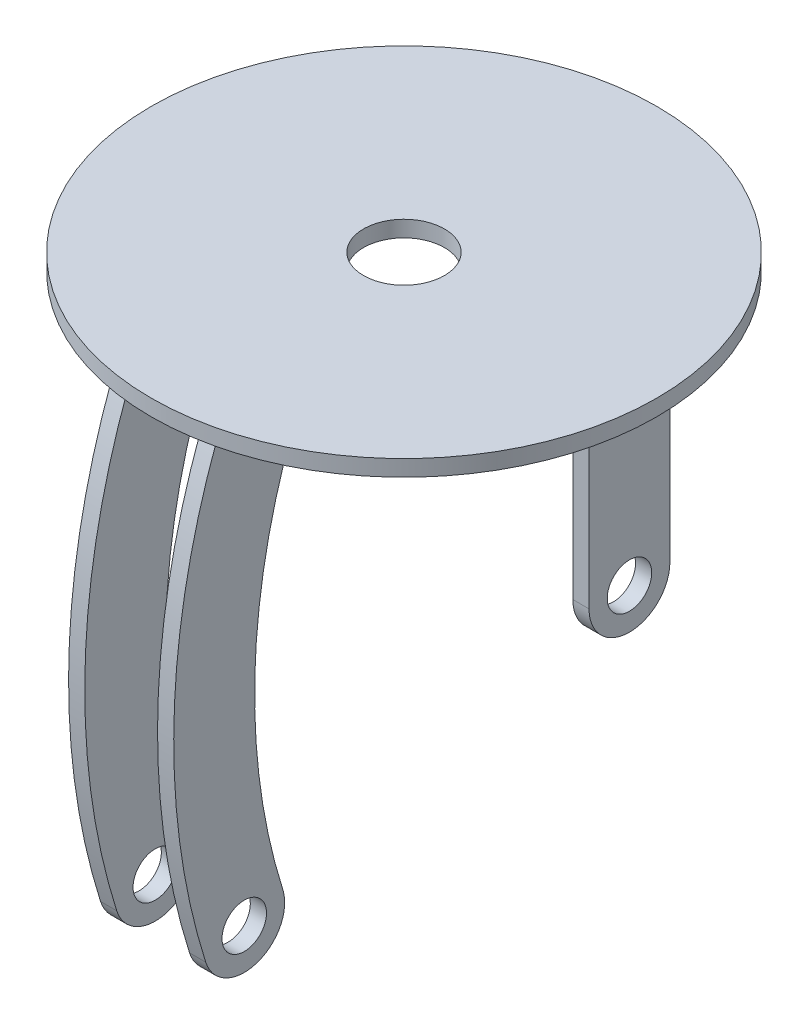
from build123d import *

# Parameters (mm, degrees)
SKETCH1_R           = 125
SKETCH1_R_2         = 20
BOSS_EXTRUDE1_DEPTH = 4
SKETCH2_W           = 8
SKETCH2_H           = 40
BOSS_EXTRUDE2_DEPTH = 99
SKETCH3_R           = 11
CUT_EXTRUDE1_DEPTH  = 287.646559372
BOSS_EXTRUDE3_START = 22
SKETCH5_R           = 11
BOSS_EXTRUDE3_DEPTH = 4
BOSS_EXTRUDE4_START = -22
SKETCH5_3_R         = 11
BOSS_EXTRUDE4_DEPTH = 4


with BuildPart() as part:
    # Sketch1 → Boss-Extrude1 (new, symmetric)
    with BuildSketch(Plane(origin=(0, 0, 0), x_dir=(1, 0, 0), z_dir=(0, 1, 0))):
        Circle(SKETCH1_R)
        Circle(SKETCH1_R_2, mode=Mode.SUBTRACT)
    extrude(amount=BOSS_EXTRUDE1_DEPTH, both=True)

    # Sketch2 → Boss-Extrude2 (add)
    with BuildSketch(Plane.XZ.offset(4)):
        with Locations((107.5, 0)):
            Rectangle(SKETCH2_W, SKETCH2_H)
        with Locations((-107.5, 0)):
            Rectangle(SKETCH2_W, SKETCH2_H)
    extrude(amount=BOSS_EXTRUDE2_DEPTH)

    # Sketch3 → Cut-Extrude1 (cut, through all)
    with BuildSketch(Plane(origin=(111.5, 0, 0), x_dir=(0, 0, -1), z_dir=(1, 0, 0))):
        with Locations((0, -83)):
            Circle(SKETCH3_R)
        with BuildLine():
            Line((20, -103), (20, -83))
            ThreePointArc((20, -83), (14.142135624, -97.142135624), (0, -103))
            Line((0, -103), (20, -103))
        make_face()
        with BuildLine():
            ThreePointArc((0, -103), (-14.142135624, -97.142135624), (-20, -83))
            Line((-20, -83), (-20, -103))
            Line((-20, -103), (0, -103))
        make_face()
    extrude(amount=-CUT_EXTRUDE1_DEPTH, mode=Mode.SUBTRACT)

    # Sketch5 → Boss-Extrude3 (add, symmetric)
    with BuildSketch(Plane(origin=(0, 0, 0), x_dir=(0, 0, -1), z_dir=(1, 0, 0)).offset(BOSS_EXTRUDE3_START)):
        with BuildLine():
            ThreePointArc((-118.540084836, -4), (-139.773172479, -114.051826294), (-124.070028997, -225.02776858))
            ThreePointArc((-124.070028997, -225.02776858), (-98.97223142, -238.070028997), (-85.929971003, -212.97223142))
            ThreePointArc((-85.929971003, -212.97223142), (-99.503702638, -107.543747619), (-75.459915164, -4))
            Line((-75.459915164, -4), (-118.540084836, -4))
        make_face()
        with Locations((-105, -219)):
            Circle(SKETCH5_R, mode=Mode.SUBTRACT)
    extrude(amount=BOSS_EXTRUDE3_DEPTH, both=True)

    # Sketch5<3> → Boss-Extrude4 (add, symmetric)
    with BuildSketch(Plane(origin=(0, 0, 0), x_dir=(0, 0, -1), z_dir=(1, 0, 0)).offset(BOSS_EXTRUDE4_START)):
        with BuildLine():
            ThreePointArc((-118.540084836, -4), (-139.773172479, -114.051826294), (-124.070028997, -225.02776858))
            ThreePointArc((-124.070028997, -225.02776858), (-98.97223142, -238.070028997), (-85.929971003, -212.97223142))
            ThreePointArc((-85.929971003, -212.97223142), (-99.503702638, -107.543747619), (-75.459915164, -4))
            Line((-75.459915164, -4), (-118.540084836, -4))
        make_face()
        with Locations((-105, -219)):
            Circle(SKETCH5_3_R, mode=Mode.SUBTRACT)
    extrude(amount=BOSS_EXTRUDE4_DEPTH, both=True)


solid = part.part
